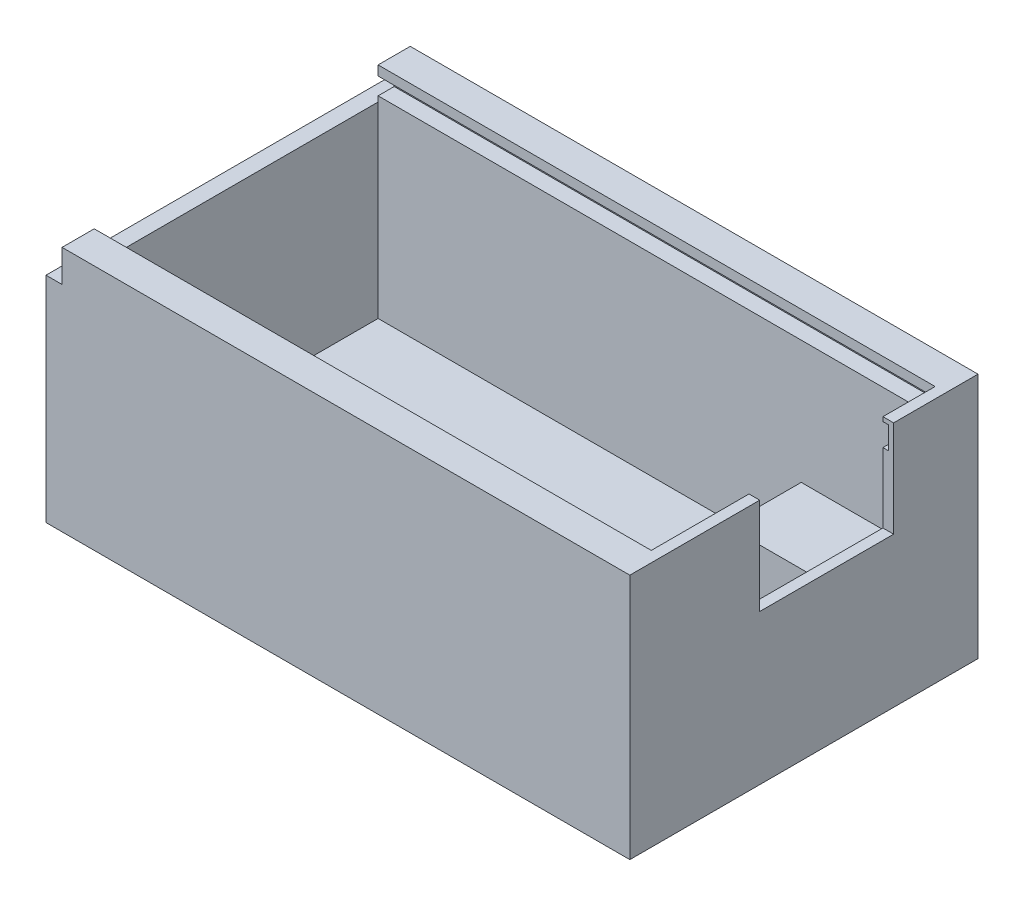
from build123d import *

# Parameters (mm, degrees)
SKETCH2_W           = 109
SKETCH2_H           = 65
SKETCH2_W_2         = 104
SKETCH2_H_2         = 53
SKETCH2_W_3         = 25
SKETCH2_H_3         = 14
BOSS_EXTRUDE1_DEPTH = 41
SKETCH3_W           = 109
SKETCH3_H           = 65
BOSS_EXTRUDE2_DEPTH = 5
SKETCH4_W           = 65
SKETCH4_H           = 6
CUT_EXTRUDE1_DEPTH  = 3
SKETCH5_W           = 25
SKETCH5_H           = 18
CUT_EXTRUDE2_DEPTH  = 10
SKETCH6_W           = 53
SKETCH6_H           = 28
CUT_EXTRUDE3_DEPTH  = 25
SKETCH7_W           = 3
SKETCH7_H           = 3.2
CUT_EXTRUDE4_DEPTH  = 105.25
SKETCH8_W           = 53
SKETCH8_H           = 4.2
CUT_EXTRUDE5_DEPTH  = 1


with BuildPart() as part:
    # Sketch2 → Boss-Extrude1 (new body)
    # profile 1 of 3: a face of its own
    with BuildSketch(Plane(origin=(0, 0, 0), x_dir=(1, 0, 0), z_dir=(0, 1, 0))):
        with Locations((51.5, 26.5)):
            Rectangle(SKETCH2_W, SKETCH2_H)
        with Locations((52, 26.5)):
            Rectangle(SKETCH2_W_2, SKETCH2_H_2, mode=Mode.SUBTRACT)
    # profile 2 of 3: a face of its own
    with BuildSketch(Plane(origin=(0, 0, 0), x_dir=(1, 0, 0), z_dir=(0, 1, 0))):
        with Locations((91.5, 46)):
            Rectangle(SKETCH2_W_3, SKETCH2_H_3)
    # profile 3 of 3: a face of its own
    with BuildSketch(Plane(origin=(0, 0, 0), x_dir=(1, 0, 0), z_dir=(0, 1, 0))):
        with Locations((91.5, 7)):
            Rectangle(SKETCH2_W_3, SKETCH2_H_3)
    extrude(amount=BOSS_EXTRUDE1_DEPTH)

    # Sketch3 → Boss-Extrude2 (add)
    with BuildSketch(Plane.XZ):
        with Locations((51.5, -26.5)):
            Rectangle(SKETCH3_W, SKETCH3_H)
    extrude(amount=BOSS_EXTRUDE2_DEPTH)

    # Sketch4 → Cut-Extrude1 (cut)
    with BuildSketch(Plane.ZY.offset(3)):
        with Locations((-26.5, 38)):
            Rectangle(SKETCH4_W, SKETCH4_H)
    extrude(amount=-CUT_EXTRUDE1_DEPTH, mode=Mode.SUBTRACT)

    # Sketch5 → Cut-Extrude2 (cut)
    with BuildSketch(Plane(origin=(106, 0, 0), x_dir=(0, 0, -1), z_dir=(1, 0, 0))):
        with Locations((30.75, 32)):
            Rectangle(SKETCH5_W, SKETCH5_H)
    extrude(amount=-CUT_EXTRUDE2_DEPTH, mode=Mode.SUBTRACT)

    # Sketch6 → Cut-Extrude3 (cut)
    with BuildSketch(Plane.ZY.offset(-79)):
        with Locations((-26.5, 27)):
            Rectangle(SKETCH6_W, SKETCH6_H)
    extrude(amount=-CUT_EXTRUDE3_DEPTH, mode=Mode.SUBTRACT)

    # Sketch7 → Cut-Extrude4 (cut)
    with BuildSketch(Plane.ZY):
        with Locations((-54.5, 37.6)):
            Rectangle(SKETCH7_W, SKETCH7_H)
        with Locations((1.5, 37.6)):
            Rectangle(SKETCH7_W, SKETCH7_H)
    extrude(amount=-CUT_EXTRUDE4_DEPTH, mode=Mode.SUBTRACT)

    # Sketch8 → Cut-Extrude5 (cut)
    with BuildSketch(Plane.ZY.offset(-104)):
        with Locations((-26.5, 38.1)):
            Rectangle(SKETCH8_W, SKETCH8_H)
    extrude(amount=-CUT_EXTRUDE5_DEPTH, mode=Mode.SUBTRACT)


solid = part.part
